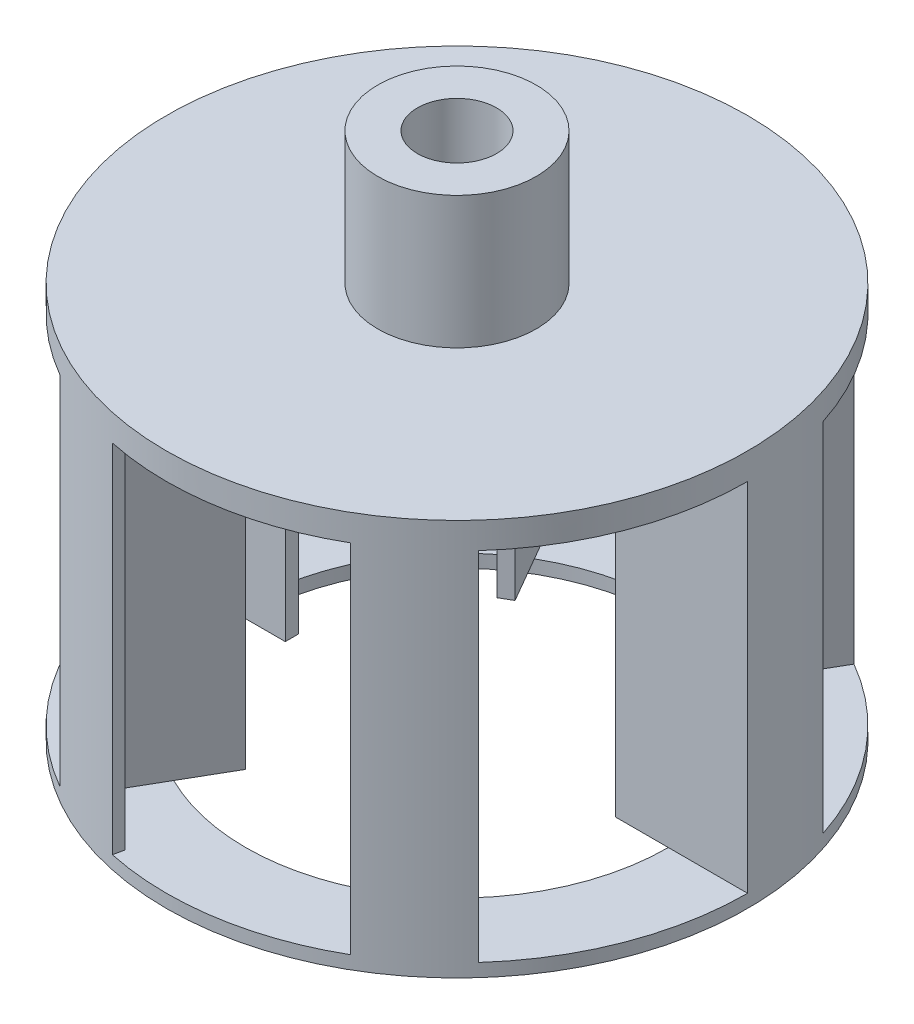
from build123d import *
from build123d.topology import SkipClean

# Parameters (mm, degrees)
BOSS_EXTRUDE1_DEPTH   = 67.5
BOSS_EXTRUDE1_2_DEPTH = 67.5
BOSS_EXTRUDE1_3_DEPTH = 67.5
BOSS_EXTRUDE1_4_DEPTH = 67.5
BOSS_EXTRUDE1_5_DEPTH = 67.5
BOSS_EXTRUDE1_6_DEPTH = 67.5
BOSS_EXTRUDE2_START   = -2.5
SKETCH2_R             = 55
SKETCH2_R_2           = 40
BOSS_EXTRUDE2_DEPTH   = 2.5
BOSS_EXTRUDE3_START   = 67.5
SKETCH3_R             = 55
SKETCH3_R_2           = 7.5
BOSS_EXTRUDE3_DEPTH   = 5
SKETCH4_R             = 15
SKETCH4_R_2           = 7.5
BOSS_EXTRUDE4_DEPTH   = 25


with BuildPart() as part:
    # Sketch1 → Boss-Extrude1 (new body)
    with BuildSketch(Plane(origin=(0, 0, 0), x_dir=(1, 0, 0), z_dir=(0, 1, 0))):
        with BuildLine():
            Line((55, 0), (30, 0))
            Line((30, 0), (30, 2.5))
            Line((30, 2.5), (52.941004902, 2.5))
            ThreePointArc((52.941004902, 2.5), (52.137315312, 9.523673244), (50.405995364, 16.377900702))
            Line((50.405995364, 16.377900702), (52.308108396, 16.995934691))
            ThreePointArc((52.308108396, 16.995934691), (54.322858733, 8.603895577), (55, 0))
        make_face()
    extrude(amount=BOSS_EXTRUDE1_DEPTH)



with BuildPart() as body_2:
    # Sketch1 → Boss-Extrude1 2 (new body)
    with BuildSketch(Plane(origin=(0, 0, 0), x_dir=(1, 0, 0), z_dir=(0, 1, 0))):
        with BuildLine():
            Line((27.5, -47.631397208), (15, -25.980762114))
            Line((15, -25.980762114), (17.165063509, -24.730762114))
            Line((17.165063509, -24.730762114), (28.63556596, -44.598255147))
            ThreePointArc((28.63556596, -44.598255147), (34.316400623, -40.390402923), (39.38667575, -35.463922137))
            Line((39.38667575, -35.463922137), (40.872965401, -36.80218335))
            ThreePointArc((40.872965401, -36.80218335), (34.612621508, -42.74302788), (27.5, -47.631397208))
        make_face()
    extrude(amount=BOSS_EXTRUDE1_2_DEPTH)


with BuildPart() as body_3:
    # Sketch1 → Boss-Extrude1 3 (new body)
    with BuildSketch(Plane(origin=(0, 0, 0), x_dir=(1, 0, 0), z_dir=(0, 1, 0))):
        with BuildLine():
            Line((-27.5, -47.631397208), (-15, -25.980762114))
            Line((-15, -25.980762114), (-12.834936491, -27.230762114))
            Line((-12.834936491, -27.230762114), (-24.305438941, -47.098255147))
            ThreePointArc((-24.305438941, -47.098255147), (-17.820914689, -49.914076167), (-11.019319613, -51.841822839))
            Line((-11.019319613, -51.841822839), (-11.435142995, -53.79811804))
            ThreePointArc((-11.435142995, -53.79811804), (-19.710237225, -51.346923457), (-27.5, -47.631397208))
        make_face()
    extrude(amount=BOSS_EXTRUDE1_3_DEPTH)


with BuildPart() as body_4:
    # Sketch1 → Boss-Extrude1 4 (new body)
    with BuildSketch(Plane(origin=(0, 0, 0), x_dir=(1, 0, 0), z_dir=(0, 1, 0))):
        with BuildLine():
            Line((-55, 0), (-30, 0))
            Line((-30, 0), (-30, -2.5))
            Line((-30, -2.5), (-52.941004902, -2.5))
            ThreePointArc((-52.941004902, -2.5), (-52.137315312, -9.523673244), (-50.405995364, -16.377900702))
            Line((-50.405995364, -16.377900702), (-52.308108396, -16.995934691))
            ThreePointArc((-52.308108396, -16.995934691), (-54.322858733, -8.603895577), (-55, 0))
        make_face()
    extrude(amount=BOSS_EXTRUDE1_4_DEPTH)


with BuildPart() as body_5:
    # Sketch1 → Boss-Extrude1 5 (new body)
    with BuildSketch(Plane(origin=(0, 0, 0), x_dir=(1, 0, 0), z_dir=(0, 1, 0))):
        with BuildLine():
            Line((-27.5, 47.631397208), (-15, 25.980762114))
            Line((-15, 25.980762114), (-17.165063509, 24.730762114))
            Line((-17.165063509, 24.730762114), (-28.63556596, 44.598255147))
            ThreePointArc((-28.63556596, 44.598255147), (-34.316400623, 40.390402923), (-39.38667575, 35.463922137))
            Line((-39.38667575, 35.463922137), (-40.872965401, 36.80218335))
            ThreePointArc((-40.872965401, 36.80218335), (-34.612621508, 42.74302788), (-27.5, 47.631397208))
        make_face()
    extrude(amount=BOSS_EXTRUDE1_5_DEPTH)


with BuildPart() as body_6:
    # Sketch1 → Boss-Extrude1 6 (new body)
    with BuildSketch(Plane(origin=(0, 0, 0), x_dir=(1, 0, 0), z_dir=(0, 1, 0))):
        with BuildLine():
            Line((27.5, 47.631397208), (15, 25.980762114))
            Line((15, 25.980762114), (12.834936491, 27.230762114))
            Line((12.834936491, 27.230762114), (24.305438941, 47.098255147))
            ThreePointArc((24.305438941, 47.098255147), (17.820914689, 49.914076167), (11.019319613, 51.841822839))
            Line((11.019319613, 51.841822839), (11.435142995, 53.79811804))
            ThreePointArc((11.435142995, 53.79811804), (19.710237225, 51.346923457), (27.5, 47.631397208))
        make_face()
    extrude(amount=BOSS_EXTRUDE1_6_DEPTH)


with BuildPart() as part_1:
    with SkipClean():  # the faces are left unmerged after this step: merging them gives an invalid solid
        add(part.part)

        add(body_2.part)  # Boss-Extrude2 merges body 2

        add(body_3.part)  # Boss-Extrude2 merges body 3

        add(body_4.part)  # Boss-Extrude2 merges body 4

        add(body_5.part)  # Boss-Extrude2 merges body 5

        add(body_6.part)  # Boss-Extrude2 merges body 6
        # Sketch2 → Boss-Extrude2 (add)
        with BuildSketch(Plane(origin=(0, 0, 0), x_dir=(1, 0, 0), z_dir=(0, 1, 0)).offset(BOSS_EXTRUDE2_START)):
            Circle(SKETCH2_R)
            Circle(SKETCH2_R_2, mode=Mode.SUBTRACT)
        extrude(amount=BOSS_EXTRUDE2_DEPTH)

    # Sketch3 → Boss-Extrude3 (add)
    with SkipClean():  # the faces are left unmerged after this step: merging them gives an invalid solid
        with BuildSketch(Plane(origin=(0, 0, 0), x_dir=(1, 0, 0), z_dir=(0, 1, 0)).offset(BOSS_EXTRUDE3_START)):
            Circle(SKETCH3_R)
            Circle(SKETCH3_R_2, mode=Mode.SUBTRACT)
        extrude(amount=BOSS_EXTRUDE3_DEPTH)

    # Sketch4 → Boss-Extrude4 (add)
    with SkipClean():  # the faces are left unmerged after this step: merging them gives an invalid solid
        with BuildSketch(Plane(origin=(0, 72.5, 0), x_dir=(1, 0, 0), z_dir=(0, 1, 0))):
            Circle(SKETCH4_R)
            Circle(SKETCH4_R_2, mode=Mode.SUBTRACT)
        extrude(amount=BOSS_EXTRUDE4_DEPTH)


solid = part_1.part
